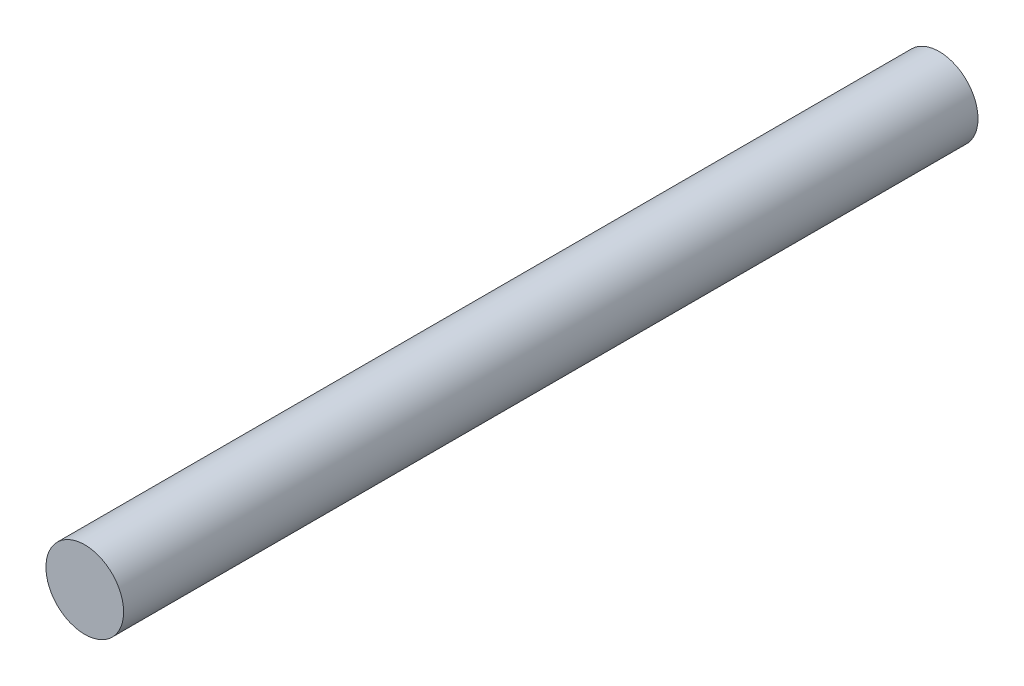
from build123d import *

# Parameters (mm, degrees)
SKETCH1_R           = 1.25
BOSS_EXTRUDE1_DEPTH = 27.5


with BuildPart() as part:
    # Sketch1 → Boss-Extrude1 (new body)
    with BuildSketch(Plane.XY):
        Circle(SKETCH1_R)
    extrude(amount=BOSS_EXTRUDE1_DEPTH)


solid = part.part
